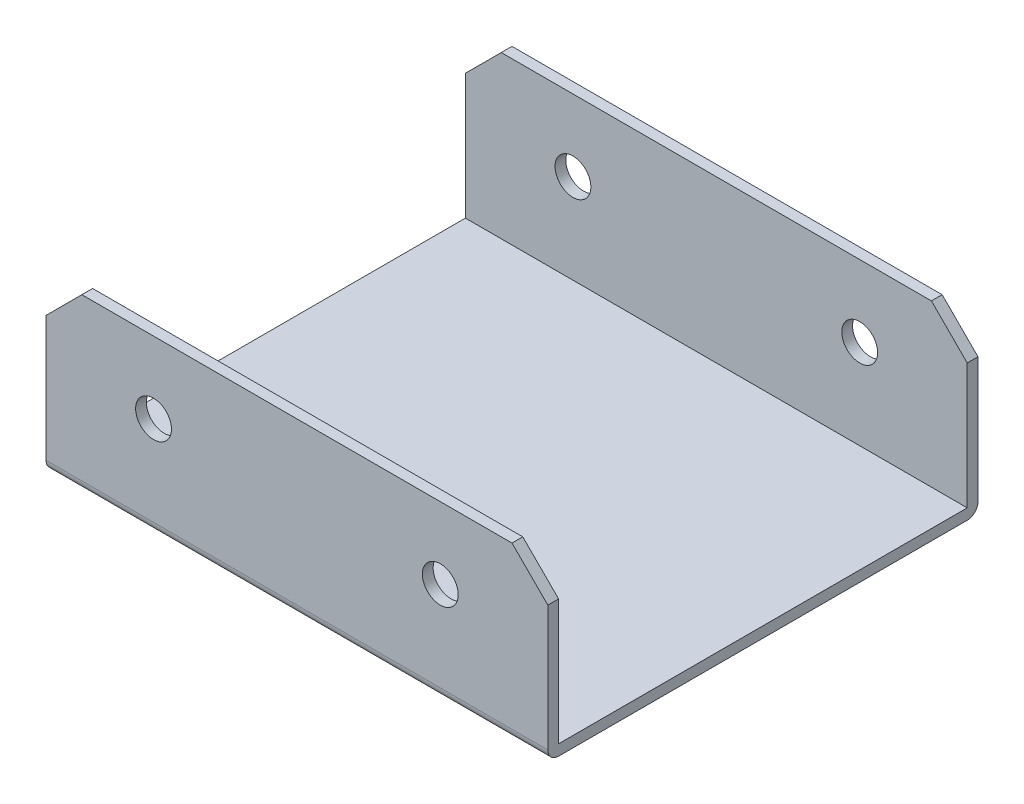
from build123d import *

# Parameters (mm, degrees)
EXTRUDE_1_DEPTH      = 35
EXTRUDE_1_DEPTH_BACK = 35
CHAMFER_1_SIZE       = 5
SKETCH_2_R           = 2.5
CUT_EXTRUDE1_DEPTH   = 74.491496107


with BuildPart() as part:
    # 草圖1 → 擠出1 (new, two sides: drawn at the far end of the back side and taken through both)
    with BuildSketch(Plane.YZ.offset(-EXTRUDE_1_DEPTH_BACK)):
        with BuildLine():
            Line((24, 30), (1.5, 30))
            ThreePointArc((1.5, 30), (0.439339828, 29.560660172), (0, 28.5))
            Line((0, 28.5), (0, -28.5))
            ThreePointArc((0, -28.5), (0.439339828, -29.560660172), (1.5, -30))
            Line((1.5, -30), (24, -30))
            Line((24, -30), (24, -28.5))
            Line((24, -28.5), (1.5, -28.5))
            Line((1.5, -28.5), (1.5, 28.5))
            Line((1.5, 28.5), (24, 28.5))
            Line((24, 28.5), (24, 30))
        make_face()
    extrude(amount=EXTRUDE_1_DEPTH + EXTRUDE_1_DEPTH_BACK)

    # 倒角1
    chamfer_1_edges = [part.edges().sort_by_distance(p)[0] for p in [
        (35, 24, 29.25),
        (35, 24, -29.25),
        (-35, 24, -29.25),
        (-35, 24, 29.25),
    ]]
    chamfer(chamfer_1_edges, length=CHAMFER_1_SIZE)

    # 草圖2 → Cut-Extrude1 (cut, through all)
    with BuildSketch(Plane.XY.offset(30)):
        with Locations((-20, 14)):
            Circle(SKETCH_2_R)
        with Locations((20, 14)):
            Circle(SKETCH_2_R)
    extrude(amount=-CUT_EXTRUDE1_DEPTH, mode=Mode.SUBTRACT)


solid = part.part
